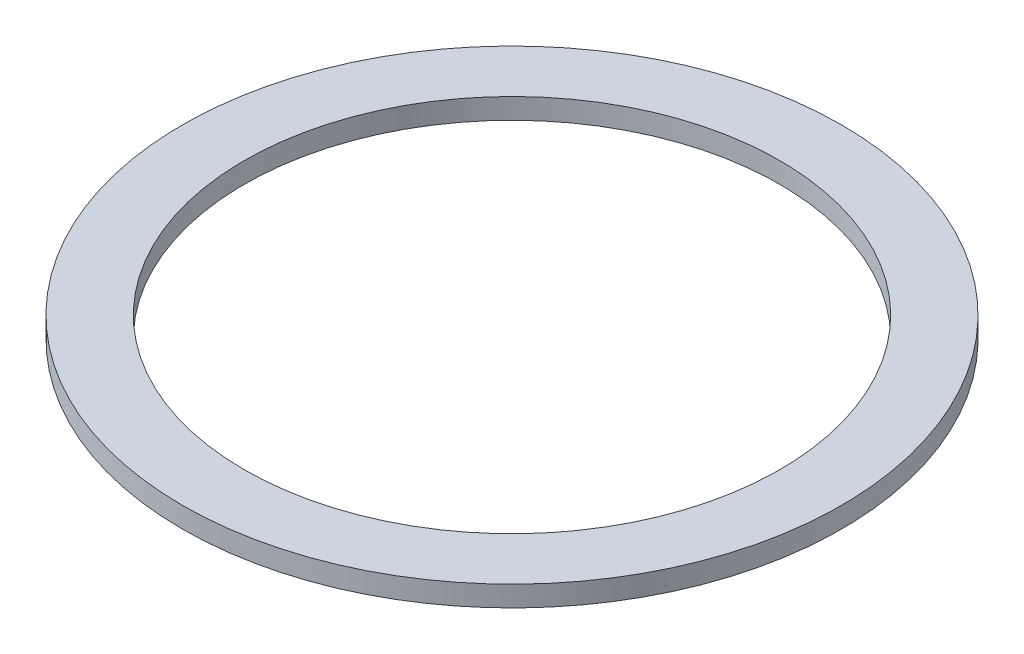
from build123d import *

# Parameters (mm, degrees)
SKETCH_1_R      = 16
SKETCH_1_R_2    = 13
EXTRUDE_1_DEPTH = 1


with BuildPart() as part:
    # Эскиз1 → Бобышка-Вытянуть1 (new body)
    with BuildSketch(Plane(origin=(0, 0, 0), x_dir=(1, 0, 0), z_dir=(0, 1, 0))):
        with Locations(Location((0, 0, 0), (0, 0, 270))):
            Circle(SKETCH_1_R)
        with Locations(Location((0, 0, 0), (0, 0, 270))):
            Circle(SKETCH_1_R_2, mode=Mode.SUBTRACT)
    extrude(amount=EXTRUDE_1_DEPTH)


solid = part.part
